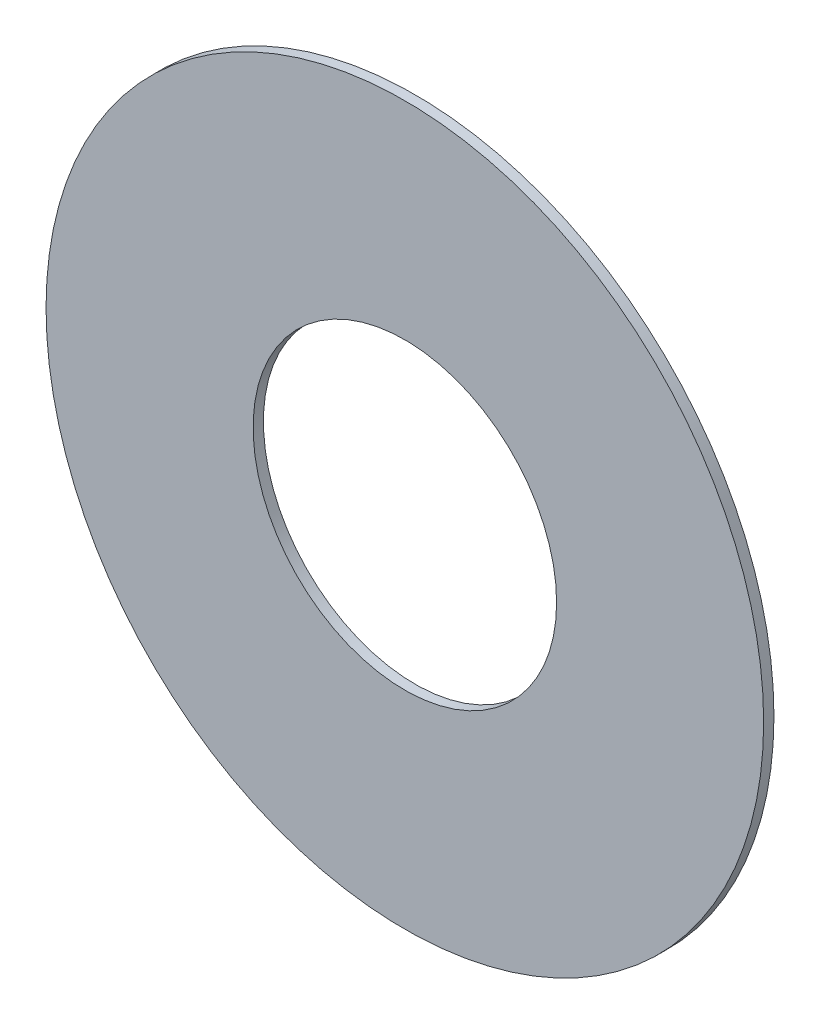
from build123d import *

# Parameters (mm, degrees)
PRINTED_GUARD_START = -42.5
SKETCH_1_R          = 69.753846154
SKETCH_1_R_2        = 29.5
PRINTED_GUARD_DEPTH = 2


with BuildPart() as part:
    # Эскиз1 → Printed_guard (new body)
    with BuildSketch(Plane.XY.offset(PRINTED_GUARD_START)):
        Circle(SKETCH_1_R)
        Circle(SKETCH_1_R_2, mode=Mode.SUBTRACT)
    extrude(amount=PRINTED_GUARD_DEPTH)


solid = part.part
